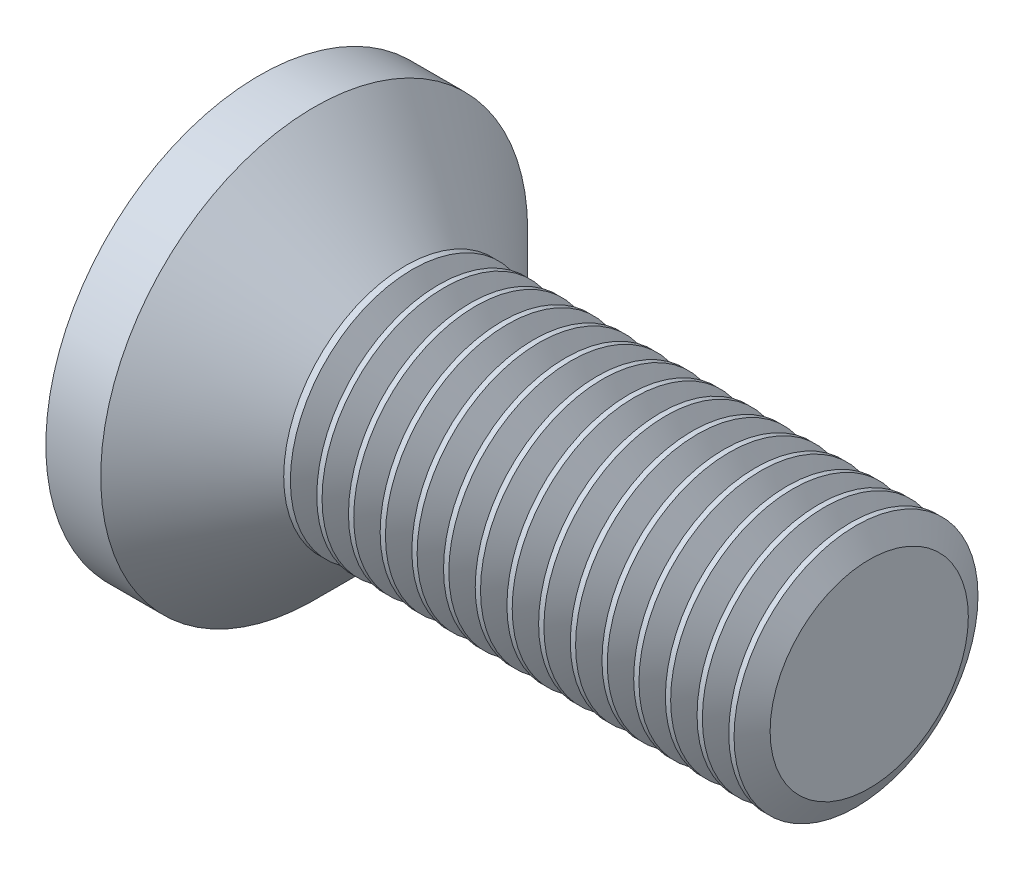
from build123d import *

# Parameters (mm, degrees)
CROSSRECESS_DEPTH = 0.6
DRAFT9_ANGLE      = 30
FILLET5_R         = 0.3
LPATTERN10_COUNT  = 15
LPATTERN10_PITCH  = 0.2598


with BuildPart() as part:
    # Sketch1 → Base (revolve)
    with BuildSketch(Plane.XY, mode=Mode.PRIVATE) as base_sk:
        Polygon((5, 1), (2, 1), (1.2, 1), (0.45, 1.75), (0, 1.75), (0, 0), (5, 0), align=None)
    revolve(base_sk.sketch.rotate(Axis((4.515812911, 0, 0), (-1, 0, 0)), 90), axis=Axis((4.515812911, 0, 0), (-1, 0, 0)))

    # Sketch6 → CrossRecess (cut)
    with BuildSketch(Plane(origin=(0, 0, 0), x_dir=(0, 0, -1), z_dir=(1, 0, 0))):
        Polygon((0.19, 0.19), (0.19, 0.95), (-0.19, 0.95), (-0.19, 0.19), (-0.95, 0.19), (-0.95, -0.19), (-0.19, -0.19), (-0.19, -0.95), (0.19, -0.95), (0.19, -0.19), (0.95, -0.19), (0.95, 0.19), align=None)
    extrude(amount=CROSSRECESS_DEPTH, mode=Mode.SUBTRACT)

    # Draft9
    draft9_faces = [part.faces().sort_by_distance(p)[0] for p in [
        (0.3, 0.95, 0),
        (0.3, 0, 0.95),
        (0.3, -0.95, 0),
        (0.3, 0, -0.95),
    ]]
    draft(draft9_faces, Plane(origin=(0, 1.75, 0), x_dir=(0, 0, -1), z_dir=(-1, 0, 0)), DRAFT9_ANGLE)

    # Fillet5
    fillet5_edges = [part.edges().sort_by_distance(p)[0] for p in [
        (0.3, 0.19, 0.19),
        (0.3, -0.19, 0.19),
        (0.3, -0.19, -0.19),
        (0.3, 0.19, -0.19),
    ]]
    fillet(fillet5_edges, radius=FILLET5_R)

    # Sketch9 → Cut-Revolve10 (revolve, cut)
    with BuildSketch(Plane.XY, mode=Mode.PRIVATE) as cut_revolve10_sk:
        Polygon((5, 0.8125055), (5.10825, 1), (5.10825, 1.2165), (4.89175, 1.2165), (4.89175, 1), align=None)
    cut_revolve10 = revolve(cut_revolve10_sk.sketch.rotate(Axis((0, 0, 0), (1, 0, 0)), 270), axis=Axis((0, 0, 0), (1, 0, 0)), mode=Mode.SUBTRACT)

    # LPattern10: Cut-Revolve10 ×15
    with Locations(*[(-i * LPATTERN10_PITCH, 0, 0) for i in range(1, LPATTERN10_COUNT)]):
        add(cut_revolve10, mode=Mode.SUBTRACT)


solid = part.part
